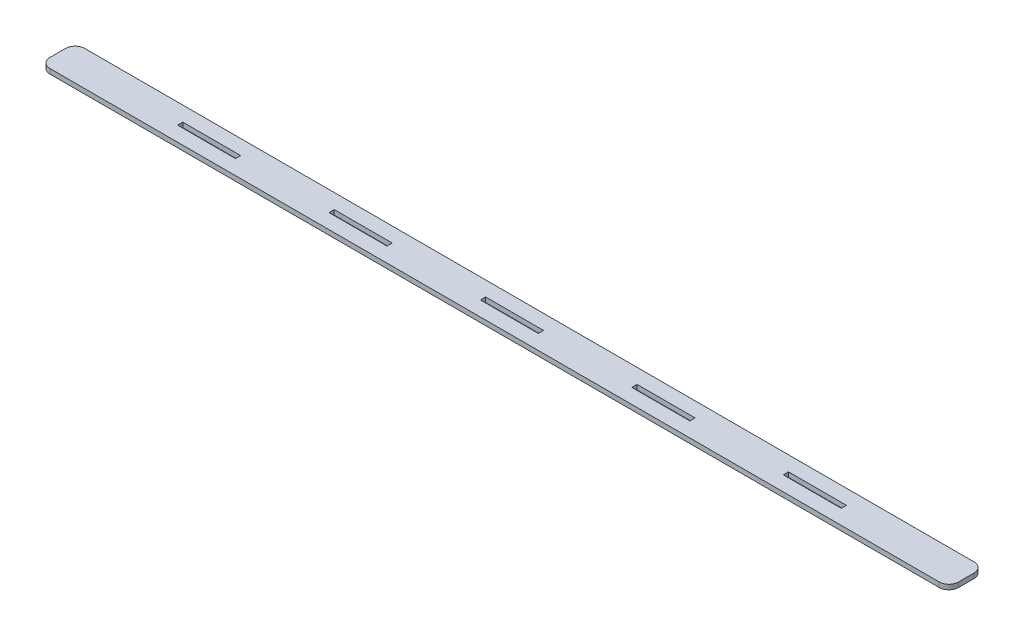
from build123d import *

# Parameters (mm, degrees)
SKETCH1_W           = 596.9
SKETCH1_H           = 22.86
BOSS_EXTRUDE1_DEPTH = 3.175
SKETCH5_W           = 38.1
SKETCH5_H           = 3.429
CUT_EXTRUDE2_DEPTH  = 299.685667592
FILLET1_R           = 6.35


with BuildPart() as part:
    # Sketch1 → Boss-Extrude1 (new body)
    with BuildSketch(Plane(origin=(0, 0, 0), x_dir=(1, 0, 0), z_dir=(0, 1, 0))):
        Rectangle(SKETCH1_W, SKETCH1_H)
    extrude(amount=BOSS_EXTRUDE1_DEPTH)

    # Sketch5 → Cut-Extrude2 (cut, through all)
    with BuildSketch(Plane(origin=(0, 3.175, 0), x_dir=(1, 0, 0), z_dir=(0, 1, 0))):
        with Locations((-198.966666582, 0)):
            Rectangle(SKETCH5_W, SKETCH5_H)
        with Locations((-99.483333164, 0)):
            Rectangle(SKETCH5_W, SKETCH5_H)
        with Locations((1.69e-07, 0)):
            Rectangle(SKETCH5_W, SKETCH5_H)
        with Locations((99.483333333, 0)):
            Rectangle(SKETCH5_W, SKETCH5_H)
        with Locations((198.966666667, 0)):
            Rectangle(SKETCH5_W, SKETCH5_H)
    extrude(amount=-CUT_EXTRUDE2_DEPTH, mode=Mode.SUBTRACT)

    # Fillet1
    fillet1_edges = [part.edges().sort_by_distance(p)[0] for p in [
        (-298.45, 1.5875, -11.43),
        (298.45, 1.5875, -11.43),
        (298.45, 1.5875, 11.43),
        (-298.45, 1.5875, 11.43),
    ]]
    fillet(fillet1_edges, radius=FILLET1_R)


solid = part.part
